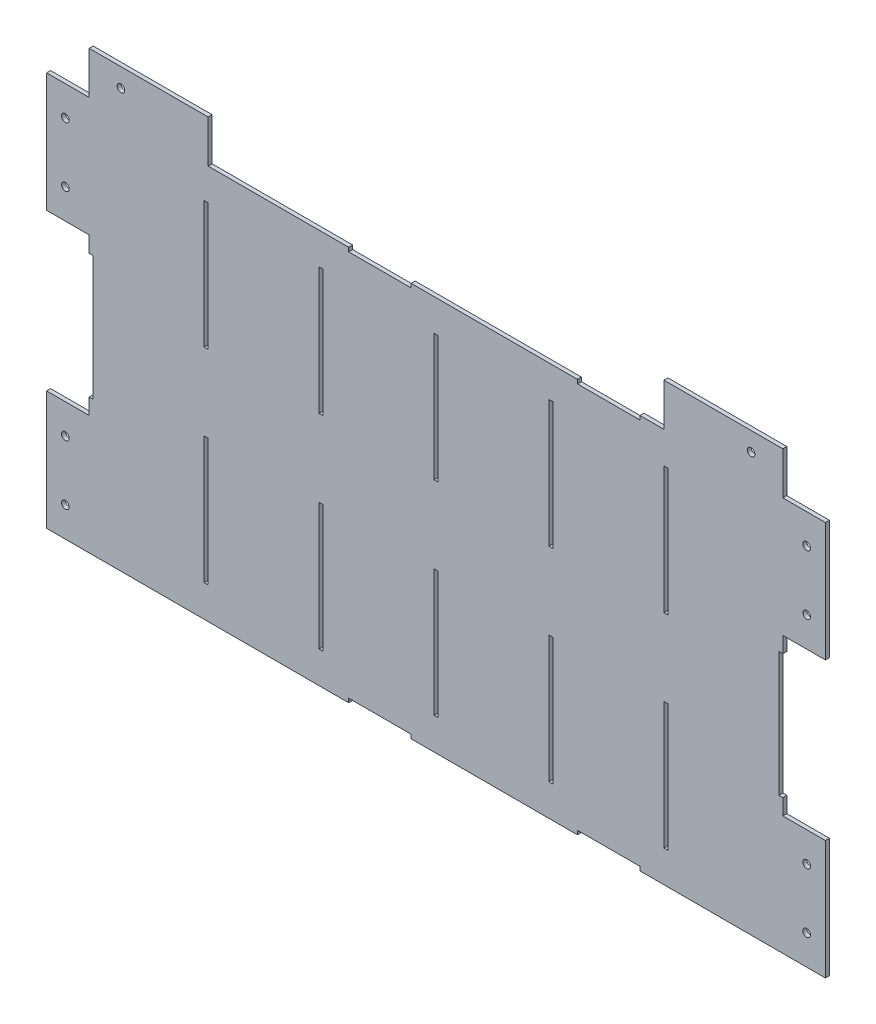
from build123d import *

# Parameters (mm, degrees)
SKETCH1_W                 = 554.905038524
SKETCH1_H                 = 315.575
BOSS_EXTRUDE1_DEPTH       = 3.175
SKETCH2_W                 = 3.175
SKETCH2_H                 = 101.6
CUT_EXTRUDE1_DEPTH        = 3.175
SKETCH7_W                 = 50
SKETCH7_H                 = 3.175
CUT_EXTRUDE5_DEPTH        = 3.175
LPATTERN2_COUNT           = 5
LPATTERN2_PITCH           = 91.96
LPATTERN2_COPY_1_SKETCH_W = 3.175
LPATTERN2_COPY_1_SKETCH_H = 101.6
LPATTERN2_COPY_1_DEPTH    = 3.175
LPATTERN2_COPY_2_SKETCH_W = 3.175
LPATTERN2_COPY_2_SKETCH_H = 101.6
LPATTERN2_COPY_2_DEPTH    = 3.175
LPATTERN2_COPY_3_SKETCH_W = 3.175
LPATTERN2_COPY_3_SKETCH_H = 101.6
LPATTERN2_COPY_3_DEPTH    = 3.175
LPATTERN2_COPY_4_SKETCH_W = 3.175
LPATTERN2_COPY_4_SKETCH_H = 101.6
LPATTERN2_COPY_4_DEPTH    = 3.175
SKETCH9_W                 = 95.12808
SKETCH9_H                 = 34.036
SKETCH9_R                 = 3.048
SKETCH9_W_2               = 34.036
SKETCH9_H_2               = 95.25
BOSS_EXTRUDE3_DEPTH       = 3.175
SKETCH10_W                = 3.175
SKETCH10_H                = 99.675
CUT_EXTRUDE6_DEPTH        = 366.829787482


with BuildPart() as part:
    # Sketch1 → Boss-Extrude1 (new body)
    with BuildSketch(Plane.XY):
        Rectangle(SKETCH1_W, SKETCH1_H)
    extrude(amount=BOSS_EXTRUDE1_DEPTH)

    # Sketch2 → Cut-Extrude1 (cut)
    with BuildSketch(Plane.XY.offset(3.175)):
        with Locations((-183.910019262, -81.5875)):
            Rectangle(SKETCH2_W, SKETCH2_H)
    cut_extrude1 = extrude(amount=-CUT_EXTRUDE1_DEPTH, mode=Mode.SUBTRACT)

    # Sketch7 → Cut-Extrude5 (cut)
    with BuildSketch(Plane.XY.offset(3.175)):
        with Locations((138.152519262, -156.2)):
            Rectangle(SKETCH7_W, SKETCH7_H)
        with Locations((-44.847480738, -156.2)):
            Rectangle(SKETCH7_W, SKETCH7_H)
    cut_extrude5 = extrude(amount=-CUT_EXTRUDE5_DEPTH, mode=Mode.SUBTRACT)

    # Mirror3: Cut-Extrude1 across plane
    add(cut_extrude1.mirror(Plane.ZX), mode=Mode.SUBTRACT)

    # LPattern2: Cut-Extrude1 ×5
    with Locations(*[(i * LPATTERN2_PITCH, 0, 0) for i in range(1, LPATTERN2_COUNT)]):
        add(cut_extrude1, mode=Mode.SUBTRACT)

    # LPattern2 copy 1 sketch → LPattern2 copy 1 (cut)
    with BuildSketch(Plane(origin=(91.96, 0, 3.175), x_dir=(1, 0, 0), z_dir=(0, 0, 1))):
        with Locations((-183.910019262, 81.5875)):
            Rectangle(LPATTERN2_COPY_1_SKETCH_W, LPATTERN2_COPY_1_SKETCH_H)
    extrude(amount=-LPATTERN2_COPY_1_DEPTH, mode=Mode.SUBTRACT)

    # LPattern2 copy 2 sketch → LPattern2 copy 2 (cut)
    with BuildSketch(Plane(origin=(183.92, 0, 3.175), x_dir=(1, 0, 0), z_dir=(0, 0, 1))):
        with Locations((-183.910019262, 81.5875)):
            Rectangle(LPATTERN2_COPY_2_SKETCH_W, LPATTERN2_COPY_2_SKETCH_H)
    extrude(amount=-LPATTERN2_COPY_2_DEPTH, mode=Mode.SUBTRACT)

    # LPattern2 copy 3 sketch → LPattern2 copy 3 (cut)
    with BuildSketch(Plane(origin=(275.88, 0, 3.175), x_dir=(1, 0, 0), z_dir=(0, 0, 1))):
        with Locations((-183.910019262, 81.5875)):
            Rectangle(LPATTERN2_COPY_3_SKETCH_W, LPATTERN2_COPY_3_SKETCH_H)
    extrude(amount=-LPATTERN2_COPY_3_DEPTH, mode=Mode.SUBTRACT)

    # LPattern2 copy 4 sketch → LPattern2 copy 4 (cut)
    with BuildSketch(Plane(origin=(367.84, 0, 3.175), x_dir=(1, 0, 0), z_dir=(0, 0, 1))):
        with Locations((-183.910019262, 81.5875)):
            Rectangle(LPATTERN2_COPY_4_SKETCH_W, LPATTERN2_COPY_4_SKETCH_H)
    extrude(amount=-LPATTERN2_COPY_4_DEPTH, mode=Mode.SUBTRACT)

    # Sketch9 → Boss-Extrude3 (add)
    # profile 1 of 3: a face of its own
    with BuildSketch(Plane(origin=(0, 0, 0), x_dir=(-1, 0, 0), z_dir=(0, 0, -1))):
        with Locations((-229.888479262, 174.8055)):
            Rectangle(SKETCH9_W, SKETCH9_H)
        with Locations((-252.052519262, 176.8375)):
            Circle(SKETCH9_R, mode=Mode.SUBTRACT)
    # profile 2 of 3: a face of its own
    with BuildSketch(Plane(origin=(0, 0, 0), x_dir=(-1, 0, 0), z_dir=(0, 0, -1))):
        with Locations((-294.470519262, 110.1625)):
            Rectangle(SKETCH9_W_2, SKETCH9_H_2)
        with Locations((-296.502519262, 86.35)):
            Circle(SKETCH9_R, mode=Mode.SUBTRACT)
        with Locations((-296.502519262, 133.975)):
            Circle(SKETCH9_R, mode=Mode.SUBTRACT)
    # profile 3 of 3: a face of its own
    with BuildSketch(Plane(origin=(0, 0, 0), x_dir=(-1, 0, 0), z_dir=(0, 0, -1))):
        with Locations((-294.470519262, -110.1625)):
            Rectangle(SKETCH9_W_2, SKETCH9_H_2)
        with Locations((-296.502519262, -133.975)):
            Circle(SKETCH9_R, mode=Mode.SUBTRACT)
        with Locations((-296.502519262, -86.35)):
            Circle(SKETCH9_R, mode=Mode.SUBTRACT)
    boss_extrude3 = extrude(amount=-BOSS_EXTRUDE3_DEPTH)

    # Mirror4: Boss-Extrude3 across plane
    add(boss_extrude3.mirror(Plane(origin=(0, 0, 0), x_dir=(0, 0, 1), z_dir=(1, 0, 0))))

    # Mirror5: Cut-Extrude5 across plane
    add(cut_extrude5.mirror(Plane.ZX), mode=Mode.SUBTRACT)

    # Sketch10 → Cut-Extrude6 (cut, through all)
    with BuildSketch(Plane(origin=(0, 0, 0), x_dir=(-1, 0, 0), z_dir=(0, 0, -1))):
        with Locations((-275.865019262, 0)):
            Rectangle(SKETCH10_W, SKETCH10_H)
    cut_extrude6 = extrude(amount=-CUT_EXTRUDE6_DEPTH, mode=Mode.SUBTRACT)

    # Mirror6: Cut-Extrude6 across plane
    add(cut_extrude6.mirror(Plane(origin=(0, 0, 0), x_dir=(0, 0, 1), z_dir=(1, 0, 0))), mode=Mode.SUBTRACT)


solid = part.part
